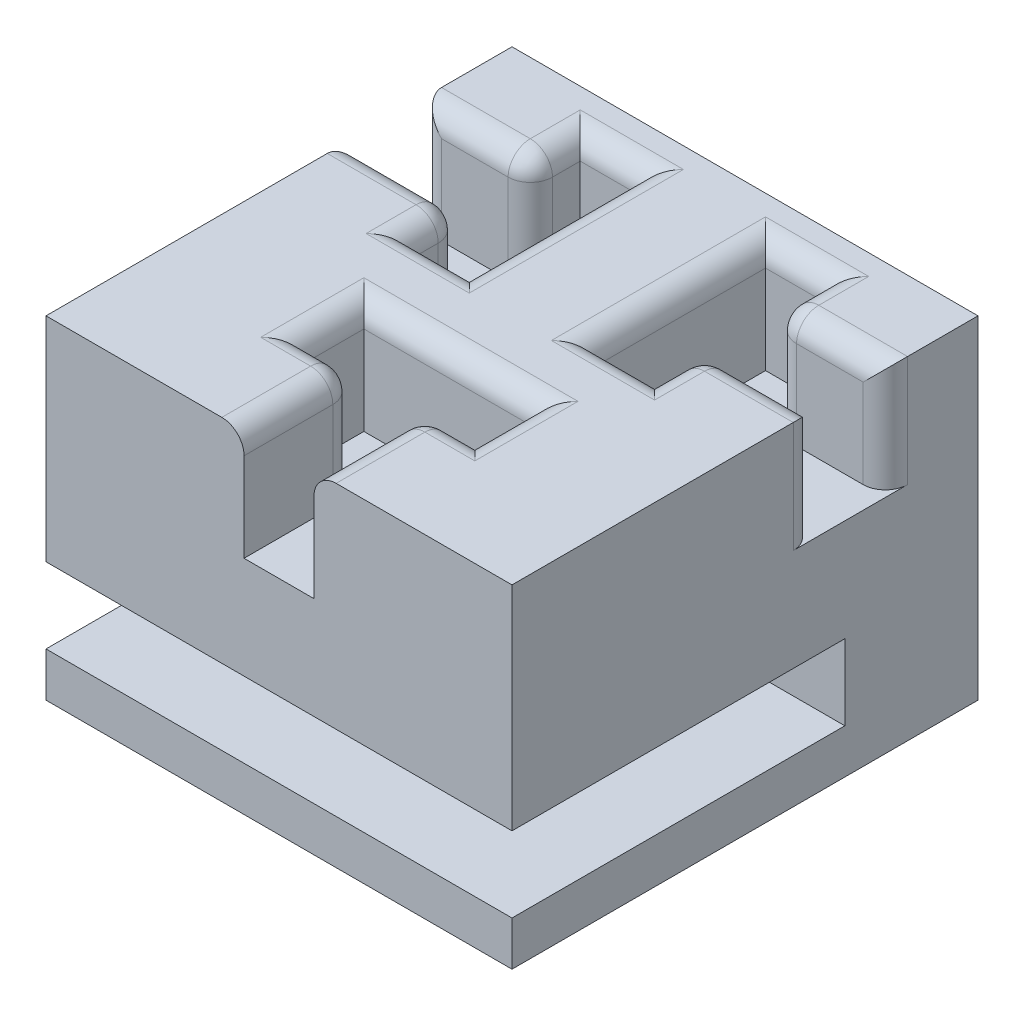
from build123d import *

# Parameters (mm, degrees)
SKETCH1_W           = 21
SKETCH1_H           = 21
BOSS_EXTRUDE1_DEPTH = 15
CUT_EXTRUDE1_DEPTH  = 5
SKETCH3_W           = 21
SKETCH3_H           = 3.4
CUT_EXTRUDE2_DEPTH  = 15
FILLET1_R           = 1


with BuildPart() as part:
    # Sketch1 → Boss-Extrude1 (new body)
    with BuildSketch(Plane(origin=(0, 0, 0), x_dir=(1, 0, 0), z_dir=(0, 1, 0))):
        Rectangle(SKETCH1_W, SKETCH1_H)
    extrude(amount=BOSS_EXTRUDE1_DEPTH)

    # Sketch2 → Cut-Extrude1 (cut)
    with BuildSketch(Plane(origin=(0, 15, 0), x_dir=(1, 0, 0), z_dir=(0, 1, 0))):
        Polygon((-10.5, 6.325), (-5.5, 6.325), (-5.5, 8.575), (-2.85, 8.575), (-2.85, 0.925), (-5.5, 0.925), (-5.5, 3.175), (-10.5, 3.175), align=None)
        Polygon((10.5, 3.175), (10.5, 6.325), (5.5, 6.325), (5.5, 8.575), (2.85, 8.575), (2.85, 0.925), (5.5, 0.925), (5.5, 3.175), align=None)
        Polygon((-3.825, -2.85), (3.825, -2.85), (3.825, -5.5), (1.575, -5.5), (1.575, -10.5), (-1.575, -10.5), (-1.575, -5.5), (-3.825, -5.5), align=None)
    extrude(amount=-CUT_EXTRUDE1_DEPTH, mode=Mode.SUBTRACT)

    # Sketch3 → Cut-Extrude2 (cut)
    with BuildSketch(Plane.XY.offset(10.5)):
        with Locations((0, 3.7)):
            Rectangle(SKETCH3_W, SKETCH3_H)
    extrude(amount=-CUT_EXTRUDE2_DEPTH, mode=Mode.SUBTRACT)

    # Fillet1
    fillet1_edges = [part.edges().sort_by_distance(p)[0] for p in [
        (2.85, 15, -4.75),
        (4.175, 15, -0.925),
        (5.5, 15, -2.05),
        (8, 15, -3.175),
        (8, 15, -6.325),
        (5.5, 15, -7.45),
        (4.175, 15, -8.575),
        (-8, 15, -6.325),
        (-5.5, 15, -7.45),
        (-4.175, 15, -8.575),
        (-2.85, 15, -4.75),
        (-4.175, 15, -0.925),
        (-5.5, 15, -2.05),
        (-8, 15, -3.175),
        (1.575, 15, 8),
        (-1.575, 15, 8),
        (-2.7, 15, 5.5),
        (-3.825, 15, 4.175),
        (2.7, 15, 5.5),
        (0, 15, 2.85),
        (3.825, 15, 4.175),
        (-10.5, 12.5, -6.325),
        (-10.5, 12.5, -3.175),
        (10.5, 12.5, -6.325),
        (10.5, 12.5, -3.175),
        (5.5, 12.5, -6.325),
        (5.5, 12.5, -3.175),
        (-5.5, 12.5, -6.325),
        (-5.5, 12.5, -3.175),
        (1.575, 12.5, 5.5),
        (-1.575, 12.5, 5.5),
    ]]
    fillet(fillet1_edges, radius=FILLET1_R)


solid = part.part
